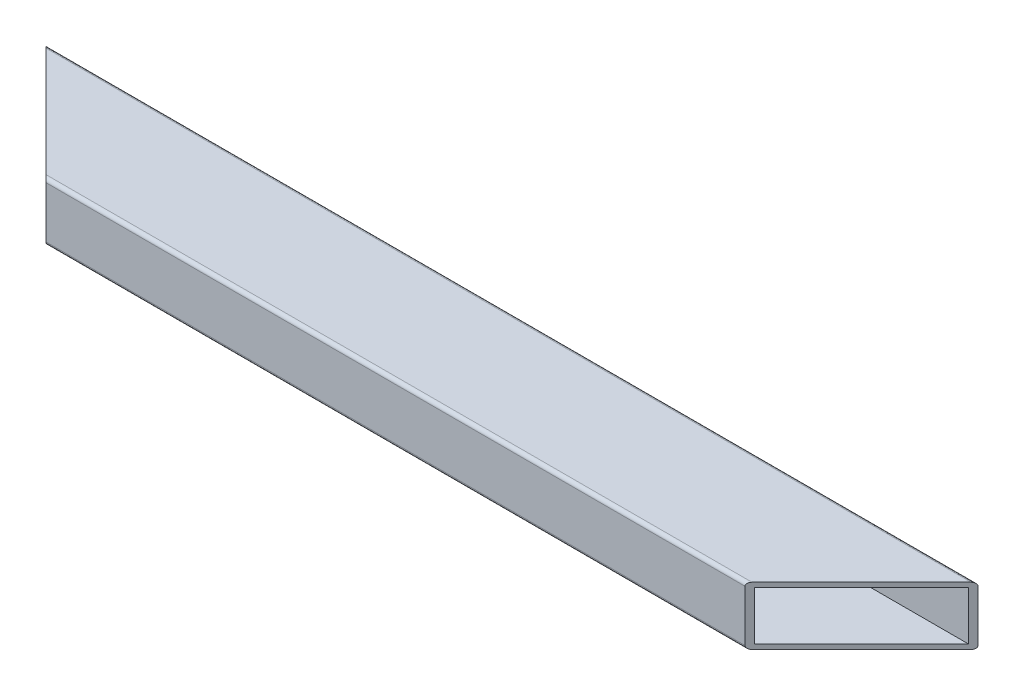
from build123d import *

# Parameters (mm, degrees)
BOSS_EXTRUDE1_DEPTH = 762
SHELL1_T            = -2


with BuildPart() as part:
    # Sketch1 → Boss-Extrude1 (new, symmetric)
    with BuildSketch(Plane(origin=(0, 0, 0), x_dir=(0, 0, -1), z_dir=(1, 0, 0))):
        with BuildLine():
            Line((-23.5, 12.5), (23.5, 12.5))
            ThreePointArc((23.5, 12.5), (24.560660172, 12.060660172), (25, 11))
            Line((25, 11), (25, -11))
            ThreePointArc((25, -11), (24.560660172, -12.060660172), (23.5, -12.5))
            Line((23.5, -12.5), (-23.5, -12.5))
            ThreePointArc((-23.5, -12.5), (-24.560660172, -12.060660172), (-25, -11))
            Line((-25, -11), (-25, 11))
            ThreePointArc((-25, 11), (-24.560660172, 12.060660172), (-23.5, 12.5))
        make_face()
    extrude(amount=BOSS_EXTRUDE1_DEPTH, both=True)

    # Shell1
    shell1_openings = [part.faces().sort_by_distance(p)[0] for p in [
        (762, 0, 0),
        (-762, 0, 0),
    ]]
    offset(amount=SHELL1_T, openings=shell1_openings, kind=Kind.INTERSECTION)

    # SurfaceCut1
    split(bisect_by=Plane(origin=(-87.5, 0, 87.5), x_dir=(0.707106781186551, 0, 0.7071067811865441), z_dir=(-0.7071067811865441, 0, 0.707106781186551)), keep=Keep.BOTTOM)

    # SurfaceCut2
    split(bisect_by=Plane(origin=(87.5, 0, 87.5), x_dir=(-0.707106781186551, 0, 0.7071067811865441), z_dir=(-0.7071067811865441, 0, -0.707106781186551)), keep=Keep.TOP)


solid = part.part
